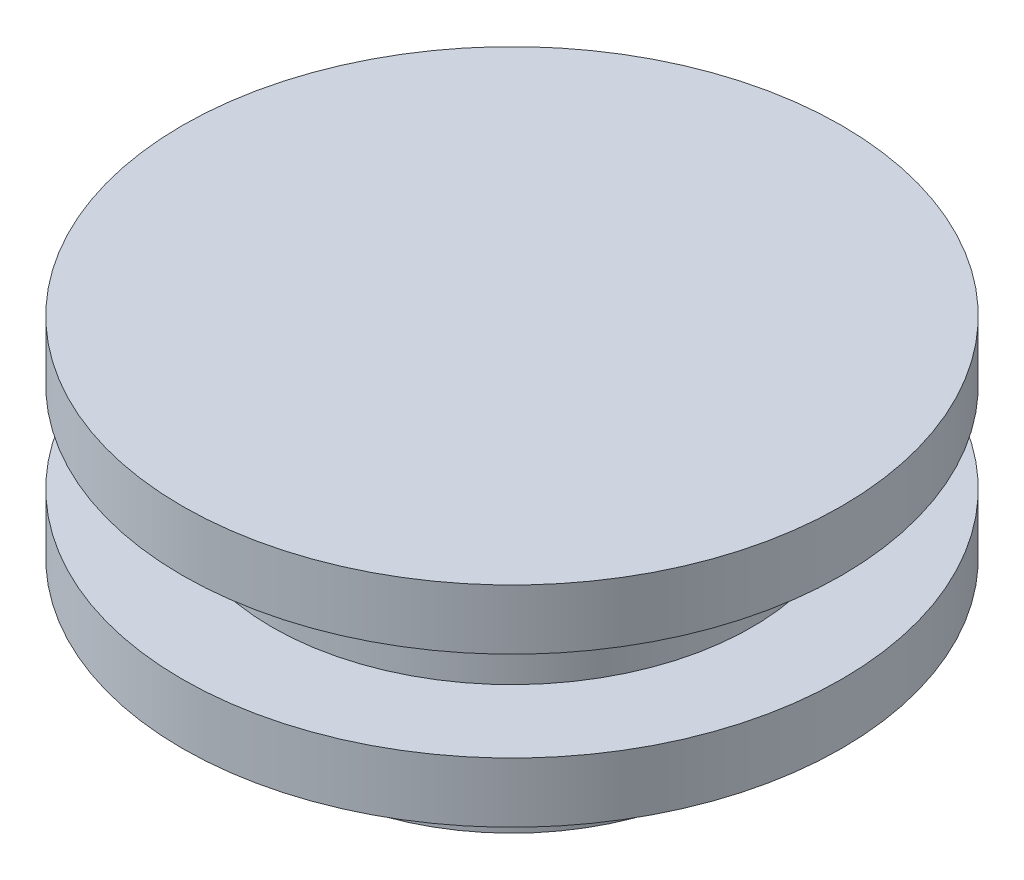
from build123d import *


with BuildPart() as part:
    # Croquis1 → Revolución1 (revolve)
    with BuildSketch(Plane.XY, mode=Mode.PRIVATE) as revoluci_n1_sk:
        Polygon((3.5, -2.5), (5.5, -2.5), (5.5, -1.5), (4, -1.5), (4, 0), (5.5, 0), (5.5, 1), (0, 1), (0, -1), (2.5, -1), (2.5, -4), (3.5, -4), align=None)
    revolve(revoluci_n1_sk.sketch.rotate(Axis((0, 5.111965401, 0), (0, -1, 0)), 90), axis=Axis((0, 5.111965401, 0), (0, -1, 0)))


solid = part.part
